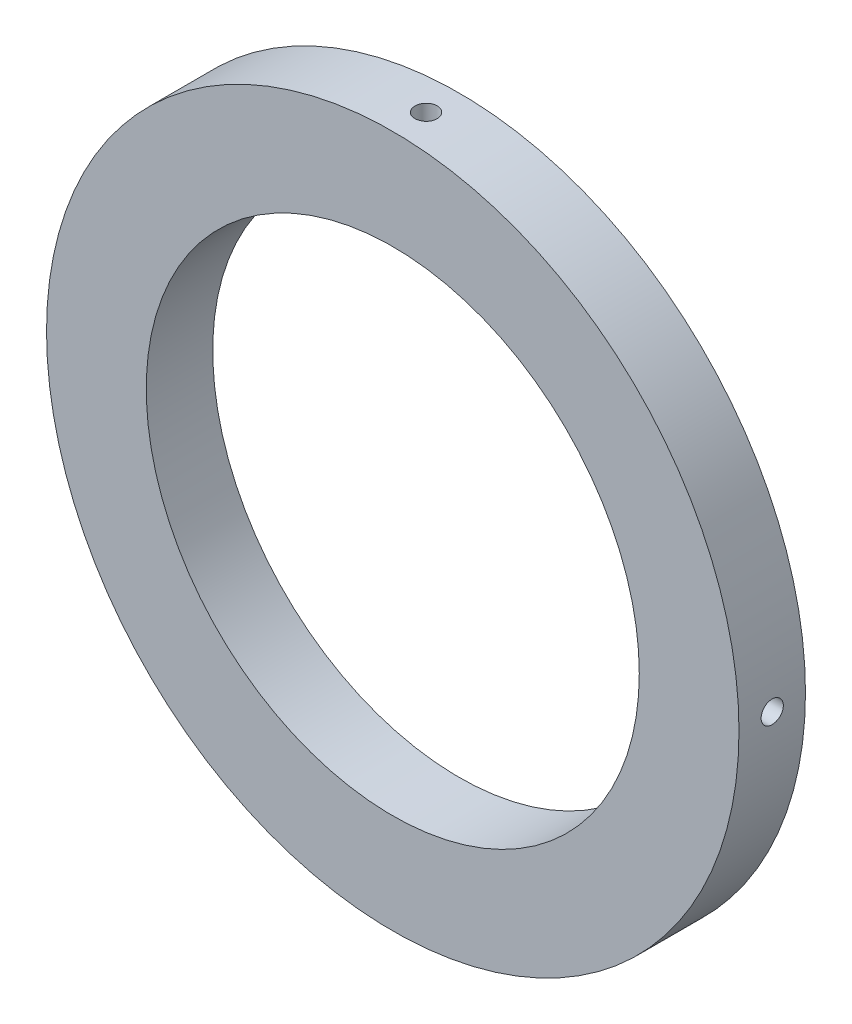
from build123d import *

# Parameters (mm, degrees)
SKETCH1_R           = 62.5
SKETCH1_R_2         = 44.5
BOSS_EXTRUDE1_DEPTH = 6
CUT_EXTRUDE1_START  = 55
SKETCH2_R           = 2
CUT_EXTRUDE1_DEPTH  = 10
CUT_EXTRUDE2_START  = -65
SKETCH2_2_R         = 2
CUT_EXTRUDE2_DEPTH  = 10
CUT_EXTRUDE3_START  = 55
SKETCH3_R           = 2
CUT_EXTRUDE3_DEPTH  = 10
CUT_EXTRUDE4_START  = -65
SKETCH3_2_R         = 2
CUT_EXTRUDE4_DEPTH  = 10


with BuildPart() as part:
    # Sketch1 → Boss-Extrude1 (new, symmetric)
    with BuildSketch(Plane.XY):
        Circle(SKETCH1_R)
        Circle(SKETCH1_R_2, mode=Mode.SUBTRACT)
    extrude(amount=BOSS_EXTRUDE1_DEPTH, both=True)

    # Sketch2 → Cut-Extrude1 (cut)
    with BuildSketch(Plane(origin=(0, 0, 0), x_dir=(1, 0, 0), z_dir=(0, 1, 0)).offset(CUT_EXTRUDE1_START)):
        Circle(SKETCH2_R)
    extrude(amount=CUT_EXTRUDE1_DEPTH, mode=Mode.SUBTRACT)

    # Sketch2<2> → Cut-Extrude2 (cut)
    with BuildSketch(Plane(origin=(0, 0, 0), x_dir=(1, 0, 0), z_dir=(0, 1, 0)).offset(CUT_EXTRUDE2_START)):
        Circle(SKETCH2_2_R)
    extrude(amount=CUT_EXTRUDE2_DEPTH, mode=Mode.SUBTRACT)

    # Sketch3 → Cut-Extrude3 (cut)
    with BuildSketch(Plane(origin=(0, 0, 0), x_dir=(0, 0, -1), z_dir=(1, 0, 0)).offset(CUT_EXTRUDE3_START)):
        Circle(SKETCH3_R)
    extrude(amount=CUT_EXTRUDE3_DEPTH, mode=Mode.SUBTRACT)

    # Sketch3<2> → Cut-Extrude4 (cut)
    with BuildSketch(Plane(origin=(0, 0, 0), x_dir=(0, 0, -1), z_dir=(1, 0, 0)).offset(CUT_EXTRUDE4_START)):
        Circle(SKETCH3_2_R)
    extrude(amount=CUT_EXTRUDE4_DEPTH, mode=Mode.SUBTRACT)


solid = part.part
